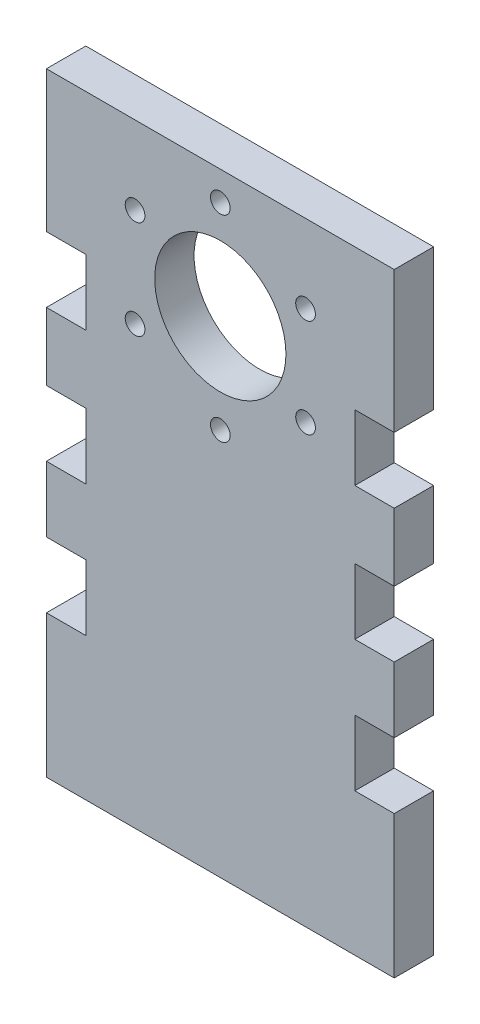
from build123d import *

# Parameters (mm, degrees)
SKETCH1_R           = 5
SKETCH1_R_2         = 0.75
BOSS_EXTRUDE1_DEPTH = 3


with BuildPart() as part:
    # Sketch1 → Boss-Extrude1 (new body)
    with BuildSketch(Plane.XY):
        Polygon((-13.25, 15.5), (-10.25, 15.5), (-10.25, 10.5), (-13.25, 10.5), (-13.25, 5.35), (-10.25, 5.35), (-10.25, 0.35), (-13.25, 0.35), (-13.25, -4.65), (-10.25, -4.65), (-10.25, -9.65), (-13.25, -9.65), (-13.25, -20.5), (13.25, -20.5), (13.25, -9.65), (10.25, -9.65), (10.25, -4.65), (13.25, -4.65), (13.25, 0.35), (10.25, 0.35), (10.25, 5.35), (13.25, 5.35), (13.25, 10.5), (10.25, 10.5), (10.25, 15.5), (13.25, 15.5), (13.25, 20.5), (13.25, 26.25), (-13.25, 26.25), (-13.25, 20.5), align=None)
        with Locations((0, 16.54)):
            Circle(SKETCH1_R, mode=Mode.SUBTRACT)
        with Locations((0, 24.04)):
            Circle(SKETCH1_R_2, mode=Mode.SUBTRACT)
        with Locations((6.495302374, 20.289806272)):
            Circle(SKETCH1_R_2, mode=Mode.SUBTRACT)
        with Locations((6.495190528, 12.79)):
            Circle(SKETCH1_R_2, mode=Mode.SUBTRACT)
        with Locations((0, 9.04)):
            Circle(SKETCH1_R_2, mode=Mode.SUBTRACT)
        with Locations((-6.495302374, 12.790193728)):
            Circle(SKETCH1_R_2, mode=Mode.SUBTRACT)
        with Locations((-6.495190528, 20.29)):
            Circle(SKETCH1_R_2, mode=Mode.SUBTRACT)
    extrude(amount=BOSS_EXTRUDE1_DEPTH)


solid = part.part
